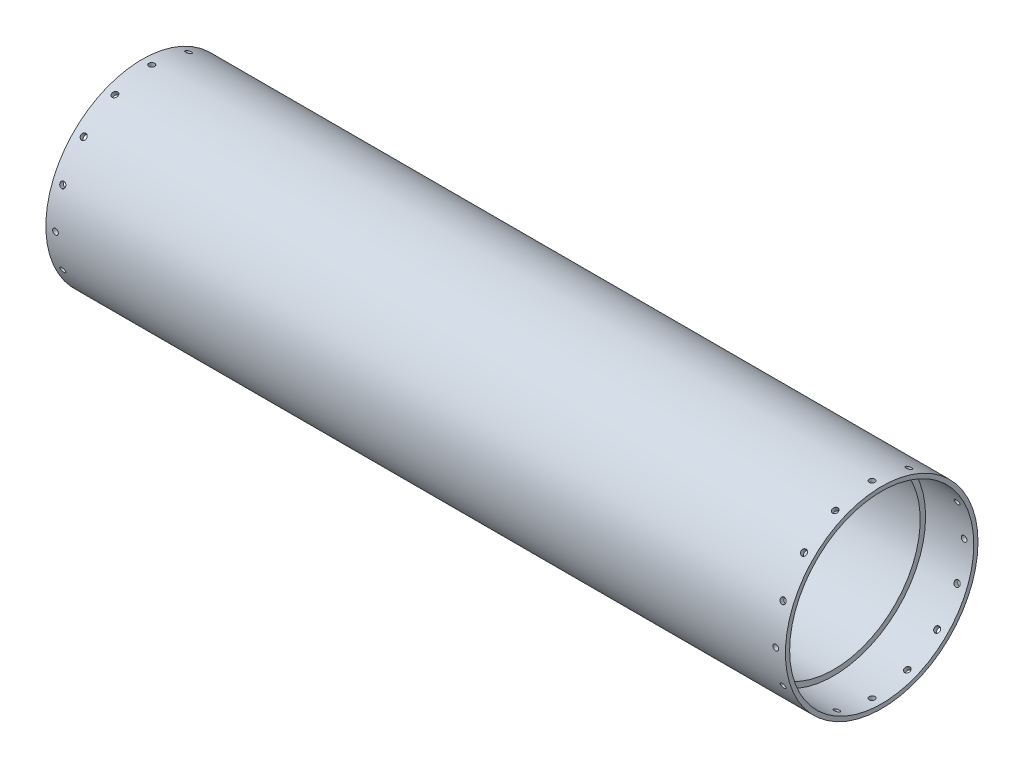
from build123d import *

# Parameters (mm, degrees)
SKETCH1_R                  = 63.5
SKETCH1_R_2                = 57.15
BOSS_EXTRUDE1_DEPTH        = 487.68
F_6_CLEARANCE_HOLE1_REACH  = 503.836
F_6_CLEARANCE_HOLE1_BORE_R = 1.89865
CIRPATTERN1_COUNT          = 16
SKETCH5_R                  = 60.706
CUT_EXTRUDE1_DEPTH         = 31.75
CUT_EXTRUDE2_START         = -31.75
SKETCH6_R                  = 60.706
CUT_EXTRUDE2_DEPTH         = 31.75


with BuildPart() as part:
    # Sketch1 → Boss-Extrude1 (new body)
    with BuildSketch(Plane(origin=(0, 0, 0), x_dir=(0, 0, -1), z_dir=(1, 0, 0))):
        with Locations(Location((0, 0, 0), (0, 0, 180))):
            Circle(SKETCH1_R)
        with Locations(Location((0, 0, 0), (0, 0, 180))):
            Circle(SKETCH1_R_2, mode=Mode.SUBTRACT)
    extrude(amount=BOSS_EXTRUDE1_DEPTH)

    # #6 Clearance Hole1 bore (on position points) → #6 Clearance Hole1 (cut, up to next)
    with BuildSketch(Plane(origin=(6.35, 63.5, 0), x_dir=(1, 0, 0), z_dir=(0, 1, 0)), mode=Mode.PRIVATE) as f_6_clearance_hole1_sk1:
        Circle(F_6_CLEARANCE_HOLE1_BORE_R)
    f_6_clearance_hole1_tool1 = extrude(f_6_clearance_hole1_sk1.sketch, amount=-F_6_CLEARANCE_HOLE1_REACH, mode=Mode.PRIVATE) & part.part
    # #6 Clearance Hole1 bore (on position points) → #6 Clearance Hole1 (cut, up to next)
    with BuildSketch(Plane(origin=(6.35, 63.5, 0), x_dir=(1, 0, 0), z_dir=(0, 1, 0)), mode=Mode.PRIVATE) as f_6_clearance_hole1_sk2:
        with Locations((474.98, 0)):
            Circle(F_6_CLEARANCE_HOLE1_BORE_R)
    f_6_clearance_hole1_tool2 = extrude(f_6_clearance_hole1_sk2.sketch, amount=-F_6_CLEARANCE_HOLE1_REACH, mode=Mode.PRIVATE) & part.part
    f_6_clearance_hole1_1 = f_6_clearance_hole1_tool1.solids().sort_by_distance((6.35, 63.5, 0))[0]
    add(f_6_clearance_hole1_1, mode=Mode.SUBTRACT)
    f_6_clearance_hole1_2 = f_6_clearance_hole1_tool2.solids().sort_by_distance((481.33, 63.5, 0))[0]
    add(f_6_clearance_hole1_2, mode=Mode.SUBTRACT)
    f_6_clearance_hole1 = f_6_clearance_hole1_1 + f_6_clearance_hole1_2  # #6 Clearance Hole1 as one shape, for the pattern or mirror that repeats it

    # CirPattern1: #6 Clearance Hole1 ×16 about axis
    cirpattern1_axis = Axis((487.68, 0, 0), (-1, 0, 0))
    for i in range(1, CIRPATTERN1_COUNT):
        add(f_6_clearance_hole1.rotate(cirpattern1_axis, i * 360 / CIRPATTERN1_COUNT), mode=Mode.SUBTRACT)

    # Sketch5 → Cut-Extrude1 (cut)
    with BuildSketch(Plane(origin=(487.68, 0, 0), x_dir=(0, 0, -1), z_dir=(1, 0, 0))):
        Circle(SKETCH5_R)
    extrude(amount=-CUT_EXTRUDE1_DEPTH, mode=Mode.SUBTRACT)

    # Sketch6 → Cut-Extrude2 (cut)
    with BuildSketch(Plane.ZY.offset(CUT_EXTRUDE2_START)):
        with Locations(Location((0, 0, 0), (0, 0, 180))):
            Circle(SKETCH6_R)
    extrude(amount=CUT_EXTRUDE2_DEPTH, mode=Mode.SUBTRACT)


solid = part.part
